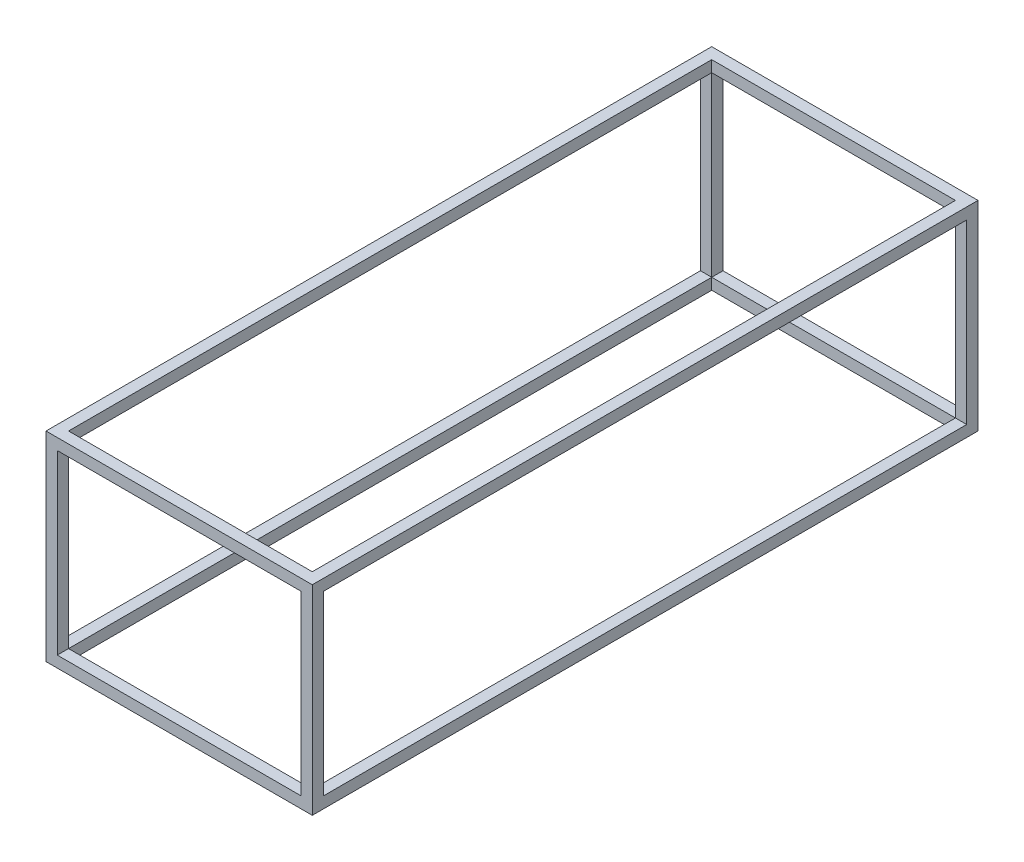
from build123d import *

# Parameters (mm, degrees)
SKETCH1_W           = 600
SKETCH1_H           = 450
SKETCH1_W_2         = 549.2
SKETCH1_H_2         = 399.2
BOSS_EXTRUDE1_DEPTH = 25.4
SKETCH2_W           = 25.4
SKETCH2_H           = 25.4
BOSS_EXTRUDE2_DEPTH = 1500
SKETCH3_W           = 600
SKETCH3_H           = 450
SKETCH3_W_2         = 549.2
SKETCH3_H_2         = 399.2
BOSS_EXTRUDE3_DEPTH = 25.4


with BuildPart() as part:
    # Sketch1 → Boss-Extrude1 (new body)
    with BuildSketch(Plane.XY):
        with Locations((300, 225)):
            Rectangle(SKETCH1_W, SKETCH1_H)
        with Locations((300, 225)):
            Rectangle(SKETCH1_W_2, SKETCH1_H_2, mode=Mode.SUBTRACT)
    extrude(amount=BOSS_EXTRUDE1_DEPTH)

    # Sketch2 → Boss-Extrude2 (add)
    with BuildSketch(Plane(origin=(0, 0, 0), x_dir=(-1, 0, 0), z_dir=(0, 0, -1))):
        with Locations((-12.7, 437.3)):
            Rectangle(SKETCH2_W, SKETCH2_H)
        with Locations((-587.3, 437.3)):
            Rectangle(SKETCH2_W, SKETCH2_H)
        with Locations((-587.3, 12.7)):
            Rectangle(SKETCH2_W, SKETCH2_H)
        with Locations((-12.7, 12.7)):
            Rectangle(SKETCH2_W, SKETCH2_H)
    extrude(amount=-BOSS_EXTRUDE2_DEPTH)

    # Sketch3 → Boss-Extrude3 (add)
    with BuildSketch(Plane.XY.offset(1500)):
        with Locations((300, 225)):
            Rectangle(SKETCH3_W, SKETCH3_H)
        with Locations((300, 225)):
            Rectangle(SKETCH3_W_2, SKETCH3_H_2, mode=Mode.SUBTRACT)
    extrude(amount=-BOSS_EXTRUDE3_DEPTH)


solid = part.part
